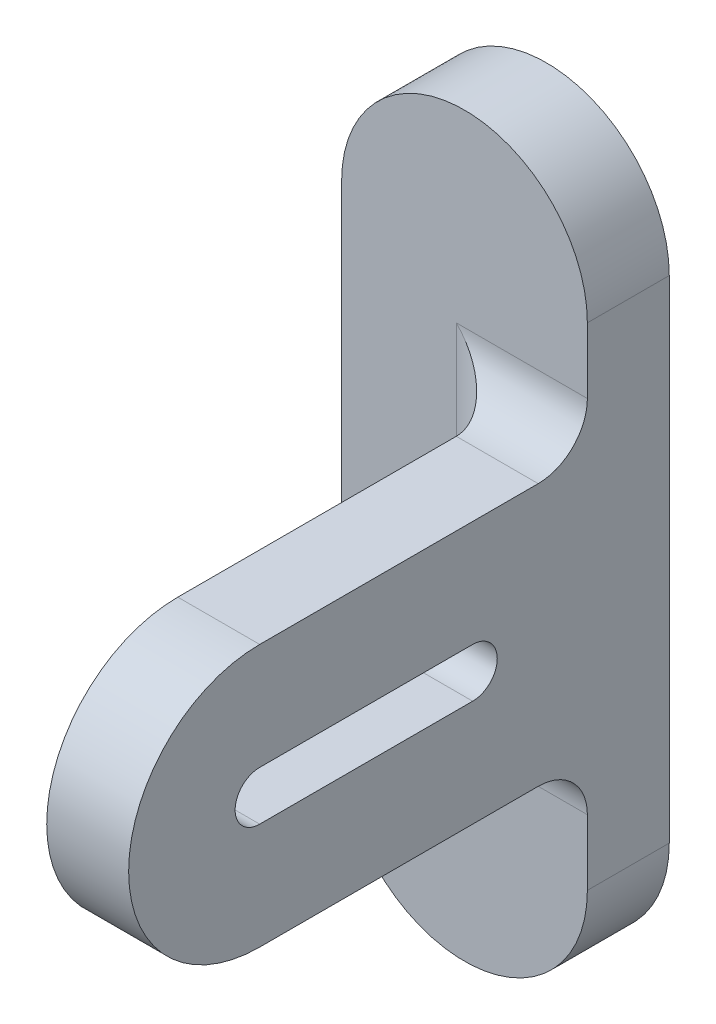
from build123d import *

# Parameters (mm, degrees)
EXTRUDE_1_DEPTH = 5
EXTRUDE_START   = -15
EXTRUDE_2_DEPTH = 5
FILLET_1_R      = 3


with BuildPart() as part:
    # Эскиз1 → Бобышка-Вытянуть1 (new body)
    with BuildSketch(Plane.XY):
        with BuildLine():
            Line((-13.101757321, 110.493831222), (-13.101757321, 80.493831222))
            ThreePointArc((-13.101757321, 80.493831222), (-20.601757321, 72.993831222), (-28.101757321, 80.493831222))
            Line((-28.101757321, 80.493831222), (-28.101757321, 110.493831222))
            ThreePointArc((-28.101757321, 110.493831222), (-20.601757321, 117.993831222), (-13.101757321, 110.493831222))
        make_face()
    extrude(amount=EXTRUDE_1_DEPTH)

    # Эскиз2 → Бобышка-Вытянуть2 (add)
    with BuildSketch(Plane.ZY.offset(28.101757321).offset(EXTRUDE_START)):
        with BuildLine():
            Line((5, 103.493831222), (25, 103.493831222))
            ThreePointArc((25, 103.493831222), (33, 95.493831222), (25, 87.493831222))
            Line((25, 87.493831222), (5, 87.493831222))
            Line((5, 87.493831222), (5, 103.493831222))
        make_face()
        with BuildLine():
            Line((25, 93.993831222), (12, 93.993831222))
            ThreePointArc((12, 93.993831222), (10.5, 95.493831222), (12, 96.993831222))
            Line((12, 96.993831222), (25, 96.993831222))
            ThreePointArc((25, 96.993831222), (26.5, 95.493831222), (25, 93.993831222))
        make_face(mode=Mode.SUBTRACT)
    extrude(amount=EXTRUDE_2_DEPTH)

    # Скругление1
    fillet_1_edges = [part.edges().sort_by_distance(p)[0] for p in [
        (-18.101757321, 95.493831222, 5),
        (-15.601757321, 87.493831222, 5),
        (-15.601757321, 103.493831222, 5),
    ]]
    fillet(fillet_1_edges, radius=FILLET_1_R)


solid = part.part
